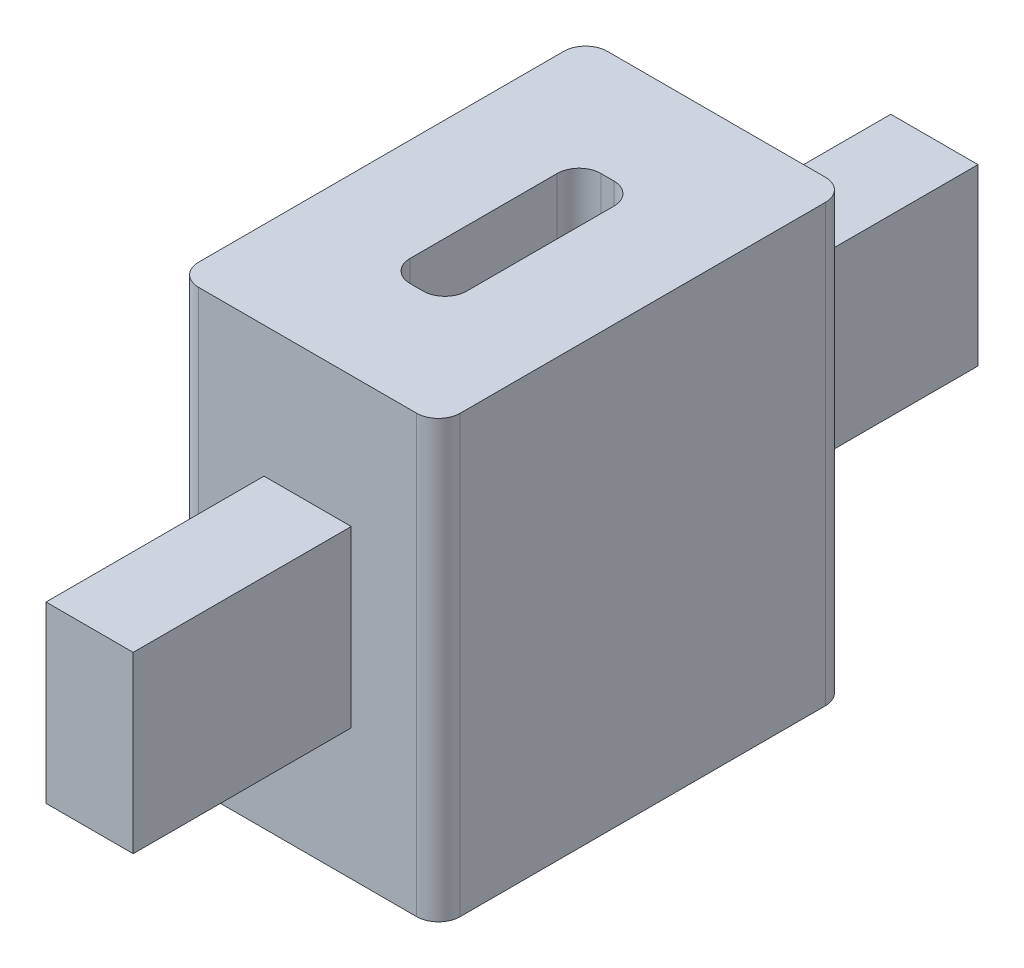
from build123d import *

# Parameters (mm, degrees)
SKETCH1_W           = 30.48
SKETCH1_H           = 47.625
BOSS_EXTRUDE1_DEPTH = 50.8
CUT_EXTRUDE1_DEPTH  = 50.8
FILLET1_R           = 2.54
FILLET2_R           = 2.54
BOSS_EXTRUDE2_DEPTH = 25.4
SKETCH4_W           = 10.16
SKETCH4_H           = 20.32
BOSS_EXTRUDE3_DEPTH = 25.4


with BuildPart() as part:
    # Sketch1 → Boss-Extrude1 (new body)
    with BuildSketch(Plane(origin=(0, 0, 0), x_dir=(1, 0, 0), z_dir=(0, 1, 0))):
        Rectangle(SKETCH1_W, SKETCH1_H)
    extrude(amount=BOSS_EXTRUDE1_DEPTH)

    # Sketch2 → Cut-Extrude1 (cut)
    with BuildSketch(Plane(origin=(0, 50.8, 0), x_dir=(1, 0, 0), z_dir=(0, 1, 0))):
        Polygon((3.302, -5.159375), (-3.302, 5.159375), (-3.302, 0), (-3.302, -11.1125), (3.302, -11.1125), align=None)
        Polygon((-3.302, 11.1125), (-3.302, 5.159375), (3.302, -5.159375), (3.302, 0), (3.302, 11.1125), (0, 11.1125), align=None)
    extrude(amount=-CUT_EXTRUDE1_DEPTH, mode=Mode.SUBTRACT)

    # Fillet1
    fillet1_edges = [part.edges().sort_by_distance(p)[0] for p in [
        (-3.302, 25.4, 11.1125),
        (-3.302, 25.4, -11.1125),
        (3.302, 25.4, -11.1125),
        (3.302, 25.4, 11.1125),
    ]]
    fillet(fillet1_edges, radius=FILLET1_R)

    # Fillet2
    fillet2_edges = [part.edges().sort_by_distance(p)[0] for p in [
        (15.24, 25.4, 23.8125),
        (-15.24, 25.4, 23.8125),
        (-15.24, 25.4, -23.8125),
        (15.24, 25.4, -23.8125),
    ]]
    fillet(fillet2_edges, radius=FILLET2_R)

    # Sketch3 → Boss-Extrude2 (add)
    with BuildSketch(Plane(origin=(0, 0, -23.8125), x_dir=(-1, 0, 0), z_dir=(0, 0, -1))):
        Polygon((-5.080578249, 35.561156499), (-5.080578249, 15.238843501), (5.080578249, 35.561156499), align=None)
        Polygon((5.080578249, 35.561156499), (-5.080578249, 15.238843501), (5.080578249, 15.238843501), align=None)
    extrude(amount=BOSS_EXTRUDE2_DEPTH)

    # Sketch4 → Boss-Extrude3 (add)
    with BuildSketch(Plane.XY.offset(23.8125)):
        with Locations((0, 25.4)):
            Rectangle(SKETCH4_W, SKETCH4_H)
    extrude(amount=BOSS_EXTRUDE3_DEPTH)


solid = part.part
